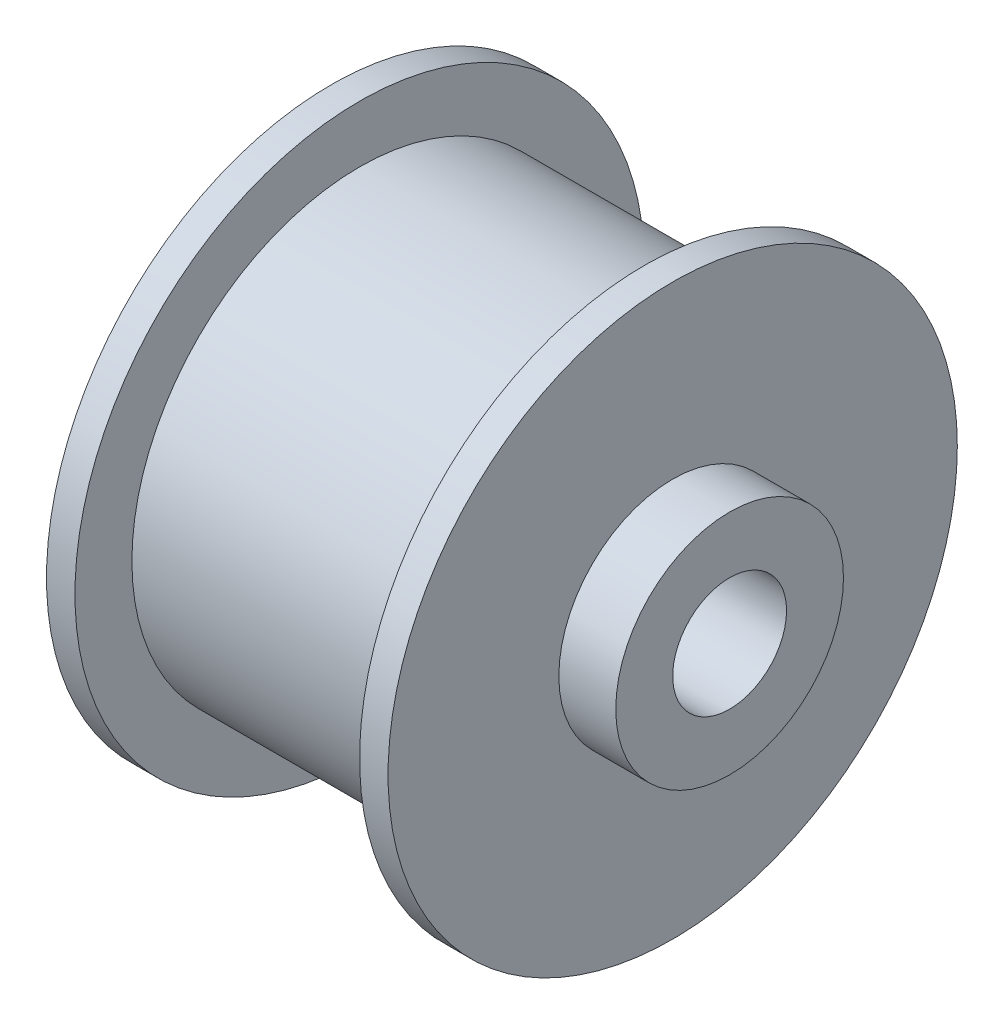
from build123d import *

# Parameters (mm, degrees)
FILLET1_R = 1


with BuildPart() as part:
    # Sketch1 → Revolve1 (revolve)
    with BuildSketch(Plane.XY, mode=Mode.PRIVATE) as revolve1_sk:
        Polygon((0, 10), (0, 25), (-2.5, 25), (-2.5, 20), (-27.5, 20), (-27.5, 25), (-30, 25), (-30, 17.5), (-25, 17.5), (-25, 7.5), (-30, 7.5), (-30, 5), (5, 5), (5, 10), align=None)
    revolve(revolve1_sk.sketch.rotate(Axis((0, 0, 0), (-1, 0, 0)), 90), axis=Axis((0, 0, 0), (-1, 0, 0)))

    # Fillet1
    fillet1_edges = [part.edges().sort_by_distance(p)[0] for p in [
        (-30, 0, 7.5),
    ]]
    fillet(fillet1_edges, radius=FILLET1_R)


solid = part.part
